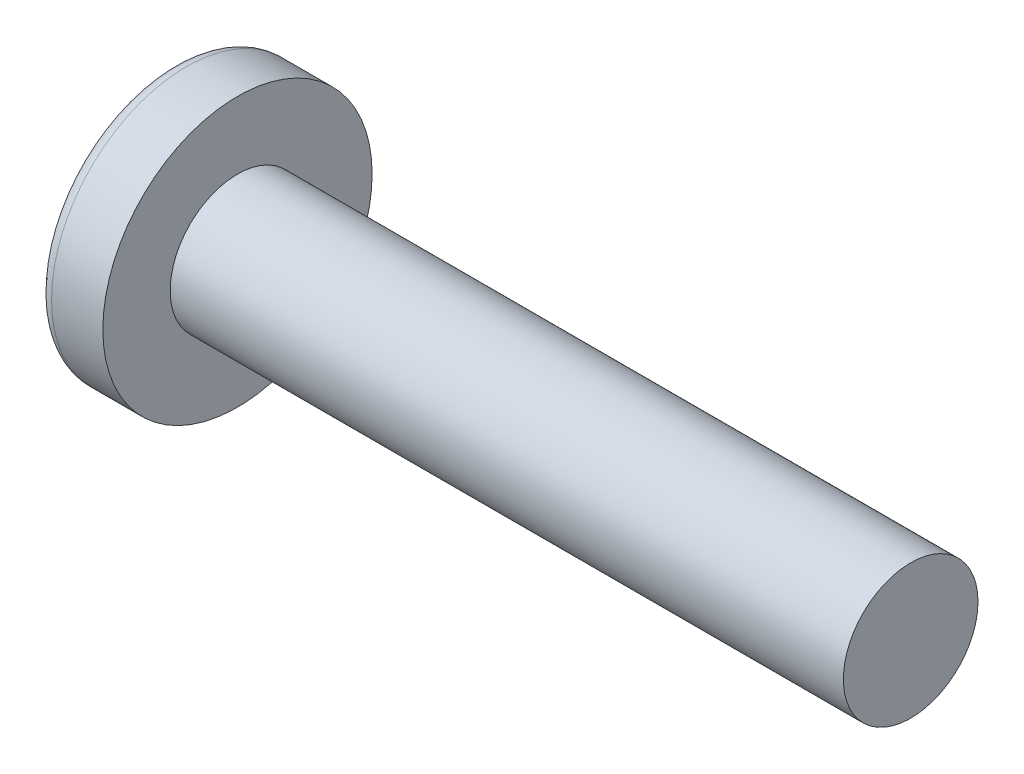
from build123d import *

# Parameters (mm, degrees)
CUT_EXTRUDE_2_DEPTH      = 0.5
PATTERN_CIRCULAR_1_COUNT = 2
PATTERN_CIRCULAR_1_ANGLE = 90
CUT_EXTRUDE_3_REACH      = 23.556
CUT_EXTRUDE_3_END_RADIUS = 6.5
SKETCH_4_R               = 0.85


with BuildPart() as part:
    # 草图1 → 旋转1 (revolve)
    with BuildSketch(Plane.XY, mode=Mode.PRIVATE) as revolve_1_sk:
        with BuildLine():
            Line((0, 0), (0, 2))
            Line((0, 2), (-20, 2))
            Line((-20, 2), (-20, 4))
            Line((-20, 4), (-21.524428901, 4))
            ThreePointArc((-21.524428901, 4), (-21.705500393, 3.956669476), (-21.847342271, 3.836065574))
            ThreePointArc((-21.847342271, 3.836065574), (-22.778904626, 2.017706029), (-23.1, 0))
            Line((-23.1, 0), (0, 0))
        make_face()
    revolve(revolve_1_sk.sketch.rotate(Axis((0, 0, 0), (-1, 0, 0)), 90), axis=Axis((0, 0, 0), (-1, 0, 0)))

    # 草图3 → 切除-拉伸2 (cut, symmetric)
    with BuildSketch(Plane.XY):
        Polygon((-20.8, -1), (-23.8, -2.495744824), (-23.8, 2.495744824), (-20.8, 1), align=None)
    cut_extrude_2 = extrude(amount=CUT_EXTRUDE_2_DEPTH, both=True, mode=Mode.SUBTRACT)

    # 阵列(圆周)1: 切除-拉伸2 ×2 about axis
    pattern_circular_1_axis = Axis((0, 0, 0), (1, 0, 0))
    for i in range(1, PATTERN_CIRCULAR_1_COUNT):
        add(cut_extrude_2.rotate(pattern_circular_1_axis, i * PATTERN_CIRCULAR_1_ANGLE / (PATTERN_CIRCULAR_1_COUNT - 1)), mode=Mode.SUBTRACT)

    # 切除-拉伸3: up to this sphere (the profile starts inside it)
    cut_extrude_3_end = Location((-16.6, 0, 0)) * Sphere(CUT_EXTRUDE_3_END_RADIUS, mode=Mode.PRIVATE)
    # 草图4 → 切除-拉伸3 (cut, up to the surface)
    with BuildSketch(Plane.ZY.offset(20.8), mode=Mode.PRIVATE) as cut_extrude_3_sk1:
        Circle(SKETCH_4_R)
    cut_extrude_3_tool1 = extrude(cut_extrude_3_sk1.sketch, amount=CUT_EXTRUDE_3_REACH, mode=Mode.PRIVATE) & cut_extrude_3_end
    add(cut_extrude_3_tool1.solids().sort_by_distance((-20.8, 0, 0))[0], mode=Mode.SUBTRACT)


solid = part.part
